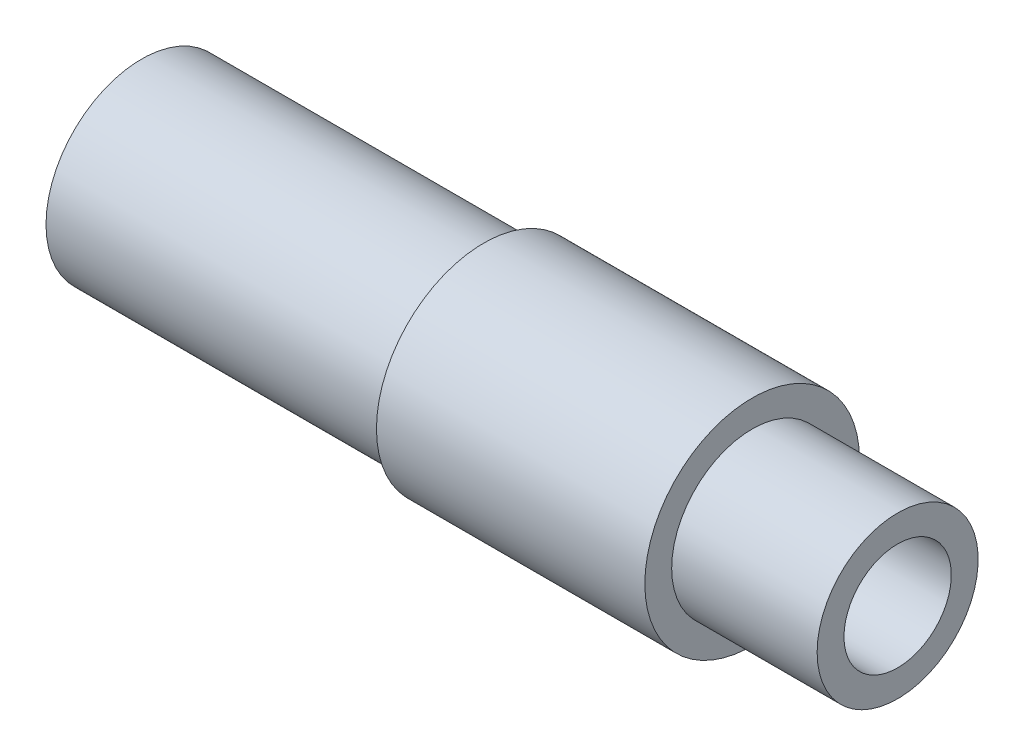
from build123d import *


with BuildPart() as part:
    # Sketch1 → Revolve1 (revolve)
    with BuildSketch(Plane.XY, mode=Mode.PRIVATE) as revolve1_sk:
        Polygon((-44.64273222, 24.757857647), (-44.64273222, 25.632857647), (-28.64273222, 25.632857647), (-28.64273222, 23.632857647), (-15.803496151, 23.632857647), (-15.803496151, 25.632857647), (-26.64273222, 25.632857647), (-26.64273222, 27.632857647), (-46.64273222, 27.632857647), (-46.64273222, 26.757857647), (-72.14273222, 26.757857647), (-72.14273222, 24.757857647), align=None)
    revolve(revolve1_sk.sketch.rotate(Axis((-83.673742698, 19.632857647, 0), (1, 0, 0)), 90), axis=Axis((-83.673742698, 19.632857647, 0), (1, 0, 0)))


solid = part.part
